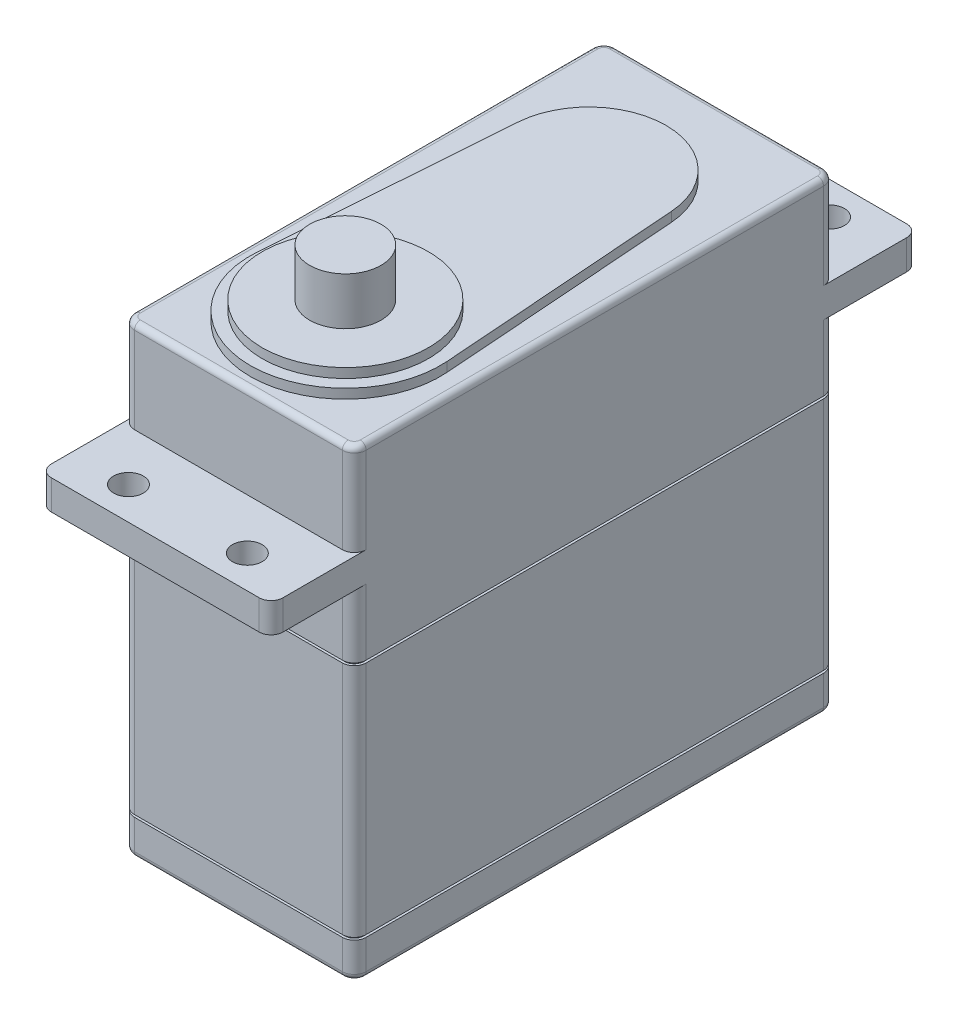
from build123d import *

# Parameters (mm, degrees)
BOSS_EXTRU_1_DEPTH        = 9.75
BOSS_EXTRU_1_DEPTH_BACK   = 9.75
ESQUISSE1_W               = 40.5
ESQUISSE1_H               = 39
BOSS_EXTRU_2_DEPTH        = 0.8
CONG_6_R                  = 1
CONG_3_R                  = 0.5
ENL_V_MAT_EXTRU_3_DEPTH   = 0.2
ENL_V_MAT_EXTRU_2_DEPTH   = 0.2
BOSS_EXTRU_3_DEPTH        = 1.25
ENL_V_MAT_EXTRU_4_REACH   = 44.593
ESQUISSE10_R              = 1.25
SYM_TRIE3_COPY_1_REACH    = 44.593
SYM_TRIE3_COPY_1_SKETCH_R = 1.25
SYM_TRIE3_COPY_2_REACH    = 44.593
SYM_TRIE3_COPY_2_SKETCH_R = 1.25


with BuildPart() as part:
    # Esquisse1 → Boss.-Extru.1 (new, two sides: drawn at the far end of the back side and taken through both)
    with BuildSketch(Plane(origin=(0, 0, 0), x_dir=(0, 0, -1), z_dir=(1, 0, 0)).offset(-BOSS_EXTRU_1_DEPTH_BACK)):
        Rectangle(ESQUISSE1_W, ESQUISSE1_H)
    extrude(amount=BOSS_EXTRU_1_DEPTH + BOSS_EXTRU_1_DEPTH_BACK)

    # Esquisse2 → Boss.-Extru.2 (add)
    with BuildSketch(Plane(origin=(13.65, 19.5, 0), x_dir=(0, 0, -1), z_dir=(0, 1, 0))):
        with BuildLine():
            Line((9.725609756, 20.13257629), (-10.664634146, 21.628555434))
            ThreePointArc((-10.664634146, 21.628555434), (-19.25, 13.65), (-10.664634146, 5.671444566))
            Line((-10.664634146, 5.671444566), (9.725609756, 7.16742371))
            ThreePointArc((9.725609756, 7.16742371), (15.75, 13.65), (9.725609756, 20.13257629))
        make_face()
    extrude(amount=BOSS_EXTRU_2_DEPTH)

    # Esquisse3 → Révolution1 (revolve)
    with BuildSketch(Plane(origin=(0, 0, 0), x_dir=(0, 0, -1), z_dir=(1, 0, 0))):
        Polygon((-4.25, 20.3), (-4.25, 21.1), (-8.25, 21.1), (-8.25, 25.1), (-11.25, 25.1), (-11.25, 20.3), align=None)
    revolve(axis=Axis((0, 19.890028941, 11.25), (0, -1, 0)))

    # Congé6
    cong_6_edges = [part.edges().sort_by_distance(p)[0] for p in [
        (9.75, 0, 20.25),
        (9.75, 0, -20.25),
        (-9.75, 0, 20.25),
        (-9.75, 0, -20.25),
    ]]
    fillet(cong_6_edges, radius=CONG_6_R)

    # Congé3
    cong_3_edges = [part.edges().sort_by_distance(p)[0] for p in [
        (0, -19.5, -20.25),
        (-9.75, -19.5, 0),
        (0, -19.5, 20.25),
        (9.75, -19.5, 0),
        (-9.75, 19.5, 0),
        (0, 19.5, 20.25),
        (9.75, 19.5, 0),
        (0, 19.5, -20.25),
        (9.457106781, -19.5, -19.957106781),
        (-9.457106781, -19.5, -19.957106781),
        (-9.457106781, -19.5, 19.957106781),
        (9.457106781, -19.5, 19.957106781),
        (-9.457106781, 19.5, -19.957106781),
        (-9.457106781, 19.5, 19.957106781),
        (9.457106781, 19.5, 19.957106781),
        (9.457106781, 19.5, -19.957106781),
    ]]
    fillet(cong_3_edges, radius=CONG_3_R)

    # Esquisse7 → Enlèv. mat.-Extru.3 (cut)
    with BuildSketch(Plane(origin=(0, -16.5, 0), x_dir=(-1, 0, 0), z_dir=(0, -1, 0))):
        with BuildLine():
            Line((8.75, -20.25), (-8.75, -20.25))
            ThreePointArc((-8.75, -20.25), (-9.457106781, -19.957106781), (-9.75, -19.25))
            Line((-9.75, -19.25), (-9.75, 19.25))
            ThreePointArc((-9.75, 19.25), (-9.457106781, 19.957106781), (-8.75, 20.25))
            Line((-8.75, 20.25), (8.75, 20.25))
            ThreePointArc((8.75, 20.25), (9.457106781, 19.957106781), (9.75, 19.25))
            Line((9.75, 19.25), (9.75, -19.25))
            ThreePointArc((9.75, -19.25), (9.457106781, -19.957106781), (8.75, -20.25))
        make_face()
        with BuildLine():
            Line((8.75, -20.05), (-8.75, -20.05))
            ThreePointArc((-8.75, -20.05), (-9.315685425, -19.815685425), (-9.55, -19.25))
            Line((-9.55, -19.25), (-9.55, 19.25))
            ThreePointArc((-9.55, 19.25), (-9.315685425, 19.815685425), (-8.75, 20.05))
            Line((-8.75, 20.05), (8.75, 20.05))
            ThreePointArc((8.75, 20.05), (9.315685425, 19.815685425), (9.55, 19.25))
            Line((9.55, 19.25), (9.55, -19.25))
            ThreePointArc((9.55, -19.25), (9.315685425, -19.815685425), (8.75, -20.05))
        make_face(mode=Mode.SUBTRACT)
    extrude(amount=-ENL_V_MAT_EXTRU_3_DEPTH, mode=Mode.SUBTRACT)

    # Esquisse6 → Enlèv. mat.-Extru.2 (cut)
    with BuildSketch(Plane(origin=(0, 3.5, 0), x_dir=(-1, 0, 0), z_dir=(0, -1, 0))):
        with BuildLine():
            Line((8.75, -20.25), (-8.75, -20.25))
            ThreePointArc((-8.75, -20.25), (-9.457106781, -19.957106781), (-9.75, -19.25))
            Line((-9.75, -19.25), (-9.75, 19.25))
            ThreePointArc((-9.75, 19.25), (-9.457106781, 19.957106781), (-8.75, 20.25))
            Line((-8.75, 20.25), (8.75, 20.25))
            ThreePointArc((8.75, 20.25), (9.457106781, 19.957106781), (9.75, 19.25))
            Line((9.75, 19.25), (9.75, -19.25))
            ThreePointArc((9.75, -19.25), (9.457106781, -19.957106781), (8.75, -20.25))
        make_face()
        with BuildLine():
            Line((8.75, -20.05), (-8.75, -20.05))
            ThreePointArc((-8.75, -20.05), (-9.315685425, -19.815685425), (-9.55, -19.25))
            Line((-9.55, -19.25), (-9.55, 19.25))
            ThreePointArc((-9.55, 19.25), (-9.315685425, 19.815685425), (-8.75, 20.05))
            Line((-8.75, 20.05), (8.75, 20.05))
            ThreePointArc((8.75, 20.05), (9.315685425, 19.815685425), (9.55, 19.25))
            Line((9.55, 19.25), (9.55, -19.25))
            ThreePointArc((9.55, -19.25), (9.315685425, -19.815685425), (8.75, -20.05))
        make_face(mode=Mode.SUBTRACT)
    extrude(amount=-ENL_V_MAT_EXTRU_2_DEPTH, mode=Mode.SUBTRACT)

    # Esquisse8 → Boss.-Extru.3 (add, symmetric)
    with BuildSketch(Plane(origin=(0, 10.5, 0), x_dir=(-1, 0, 0), z_dir=(0, -1, 0))):
        with BuildLine():
            Line((9.75, 19.25), (9.75, 26.25))
            ThreePointArc((9.75, 26.25), (9.457106781, 26.957106781), (8.75, 27.25))
            Line((8.75, 27.25), (-8.75, 27.25))
            ThreePointArc((-8.75, 27.25), (-9.457106781, 26.957106781), (-9.75, 26.25))
            Line((-9.75, 26.25), (-9.75, 19.25))
            ThreePointArc((-9.75, 19.25), (-9.457106781, 19.957106781), (-8.75, 20.25))
            Line((-8.75, 20.25), (8.75, 20.25))
            ThreePointArc((8.75, 20.25), (9.457106781, 19.957106781), (9.75, 19.25))
        make_face()
    boss_extru_3 = extrude(amount=BOSS_EXTRU_3_DEPTH, both=True)

    # Esquisse10 → Enlèv. mat.-Extru.4 (cut, up to next)
    with BuildSketch(Plane(origin=(0, 11.75, 0), x_dir=(1, 0, 0), z_dir=(0, 1, 0)), mode=Mode.PRIVATE) as enl_v_mat_extru_4_sk1:
        with Locations((5, 24.5)):
            Circle(ESQUISSE10_R)
    enl_v_mat_extru_4_tool1 = extrude(enl_v_mat_extru_4_sk1.sketch, amount=-ENL_V_MAT_EXTRU_4_REACH, mode=Mode.PRIVATE) & part.part
    enl_v_mat_extru_4 = enl_v_mat_extru_4_tool1.solids().sort_by_distance((5, 11.75, -24.5))[0]
    add(enl_v_mat_extru_4, mode=Mode.SUBTRACT)

    # Symétrie1: Boss.-Extru.3 across plane
    add(boss_extru_3.mirror(Plane.XY))

    # Symétrie2: Enlèv. mat.-Extru.4 across plane
    add(enl_v_mat_extru_4.mirror(Plane(origin=(0, 0, 0), x_dir=(0, 0, 1), z_dir=(1, 0, 0))), mode=Mode.SUBTRACT)

    # Symétrie3 copy 1 sketch → Symétrie3 copy 1 (cut, up to next)
    with BuildSketch(Plane(origin=(0, 11.75, 0), x_dir=(-1, 0, 0), z_dir=(0, 1, 0)), mode=Mode.PRIVATE) as sym_trie3_copy_1_sk1:
        with Locations((5, 24.5)):
            Circle(SYM_TRIE3_COPY_1_SKETCH_R)
    sym_trie3_copy_1_tool1 = extrude(sym_trie3_copy_1_sk1.sketch, amount=-SYM_TRIE3_COPY_1_REACH, mode=Mode.PRIVATE) & part.part
    add(sym_trie3_copy_1_tool1.solids().sort_by_distance((-5, 11.75, 24.5))[0], mode=Mode.SUBTRACT)

    # Symétrie3 copy 2 sketch → Symétrie3 copy 2 (cut, up to next)
    with BuildSketch(Plane(origin=(0, 11.75, 0), x_dir=(1, 0, 0), z_dir=(0, 1, 0)), mode=Mode.PRIVATE) as sym_trie3_copy_2_sk1:
        with Locations((5, -24.5)):
            Circle(SYM_TRIE3_COPY_2_SKETCH_R)
    sym_trie3_copy_2_tool1 = extrude(sym_trie3_copy_2_sk1.sketch, amount=-SYM_TRIE3_COPY_2_REACH, mode=Mode.PRIVATE) & part.part
    add(sym_trie3_copy_2_tool1.solids().sort_by_distance((5, 11.75, 24.5))[0], mode=Mode.SUBTRACT)


solid = part.part
